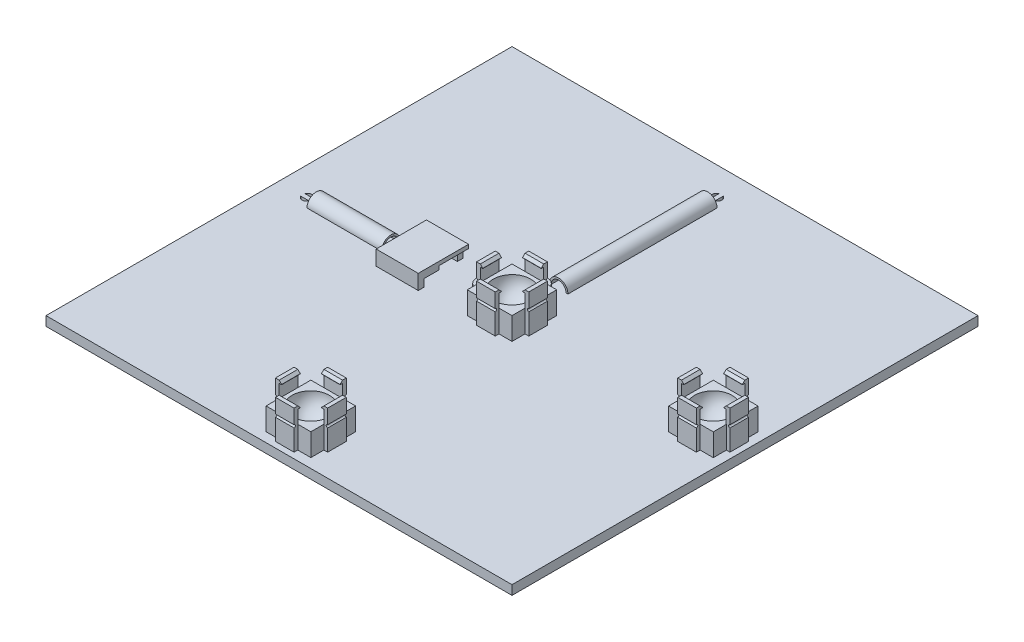
from build123d import *

# Parameters (mm, degrees)
SKETCH1_W            = 250
SKETCH1_H            = 250
BOSS_EXTRUDE1_DEPTH  = 5
SKETCH2_W            = 24
SKETCH2_H            = 24
BOSS_EXTRUDE2_DEPTH  = 12
BOSS_EXTRUDE3_DEPTH  = 19
BOSS_EXTRUDE5_DEPTH  = 10
BOSS_EXTRUDE6_DEPTH  = 10
BOSS_EXTRUDE7_DEPTH  = 10
BOSS_EXTRUDE8_DEPTH  = 10
SKETCH12_R           = 0.75
CUT_EXTRUDE1_DEPTH   = 347.058798176
SKETCH13_R           = 0.75
CUT_EXTRUDE2_DEPTH   = 283.931528819
SKETCH14_R           = 0.75
CUT_EXTRUDE3_DEPTH   = 283.931528819
SKETCH15_R           = 0.75
CUT_EXTRUDE4_DEPTH   = 283.931528819
FILLET1_R            = 0.1
CUT_EXTRUDE5_DEPTH   = 2.3
CUT_EXTRUDE6_DEPTH   = 355.313759259
BOSS_EXTRUDE9_START  = -150
BOSS_EXTRUDE9_DEPTH  = 80
BOSS_EXTRUDE10_START = 20
BOSS_EXTRUDE10_DEPTH = 40
BOSS_EXTRUDE11_DEPTH = 6
SKETCH22_W           = 22.6
SKETCH22_H           = 27
BOSS_EXTRUDE12_DEPTH = 2
CUT_EXTRUDE7_START   = -4
SKETCH23_W           = 3
SKETCH23_H           = 8
CUT_EXTRUDE7_DEPTH   = 4
CUT_EXTRUDE8_DEPTH   = 6
BOSS_EXTRUDE13_START = 5
BOSS_EXTRUDE13_DEPTH = 3
BOSS_EXTRUDE14_START = 5
BOSS_EXTRUDE14_DEPTH = 3


with BuildPart() as part:
    # Sketch1 → Boss-Extrude1 (new body)
    with BuildSketch(Plane(origin=(0, 0, 0), x_dir=(1, 0, 0), z_dir=(0, 1, 0))):
        with Locations((125, 125)):
            Rectangle(SKETCH1_W, SKETCH1_H)
    extrude(amount=BOSS_EXTRUDE1_DEPTH)

    # Sketch2 → Boss-Extrude2 (add)
    with BuildSketch(Plane(origin=(0, 5, 0), x_dir=(1, 0, 0), z_dir=(0, 1, 0))):
        with Locations((125, 125)):
            Rectangle(SKETCH2_W, SKETCH2_H)
        with Locations((233, 125)):
            Rectangle(SKETCH2_W, SKETCH2_H)
        with Locations((125, 17.078916875)):
            Rectangle(SKETCH2_W, SKETCH2_H)
    extrude(amount=BOSS_EXTRUDE2_DEPTH)

    # Sketch4 → Cut-Revolve1 (revolve, cut)
    with BuildSketch(Plane(origin=(0, 17, 0), x_dir=(1, 0, 0), z_dir=(0, 1, 0))):
        with BuildLine():
            Line((125, 115), (125, 135))
            ThreePointArc((125, 135), (115, 125), (125, 115))
        make_face()
    revolve(axis=Axis((125, 17, -135), (0, 0, 1)), mode=Mode.SUBTRACT)

    # Sketch4<3> → Cut-Revolve2 (revolve, cut)
    with BuildSketch(Plane(origin=(0, 17, 0), x_dir=(1, 0, 0), z_dir=(0, 1, 0))):
        with BuildLine():
            Line((233, 135), (233, 115))
            ThreePointArc((233, 115), (243, 125), (233, 135))
        make_face()
    revolve(axis=Axis((233, 17, -135), (0, 0, 1)), mode=Mode.SUBTRACT)

    # Sketch4<4> → Cut-Revolve3 (revolve, cut)
    with BuildSketch(Plane(origin=(0, 17, 0), x_dir=(1, 0, 0), z_dir=(0, 1, 0))):
        with BuildLine():
            Line((125, 7), (125, 27))
            ThreePointArc((125, 27), (115, 17), (125, 7))
        make_face()
    revolve(axis=Axis((125, 17, -7), (0, 0, -1)), mode=Mode.SUBTRACT)

    # Sketch5 → Boss-Extrude3 (add)
    with BuildSketch(Plane(origin=(0, 5, 0), x_dir=(1, 0, 0), z_dir=(0, 1, 0))):
        Polygon((125, 137), (130, 137), (130, 139), (120, 139), (120, 137), align=None)
        Polygon((120, 113), (125, 113), (130, 113), (130, 111), (120, 111), align=None)
        Polygon((125, 29.078916875), (130, 29.078916875), (130, 31.078916875), (120, 31.078916875), (120, 29.078916875), align=None)
        Polygon((120, 5.078916875), (125, 5.078916875), (130, 5.078916875), (130, 3.078916875), (120, 3.078916875), align=None)
        Polygon((113, 130), (113, 125), (113, 120), (111, 120), (111, 130), align=None)
        Polygon((137, 125), (137, 120), (139, 120), (139, 130), (137, 130), align=None)
        Polygon((220.921083125, 130), (220.921083125, 125), (220.921083125, 120), (218.921083125, 120), (218.921083125, 130), align=None)
        Polygon((244.921083125, 125), (244.921083125, 120), (246.921083125, 120), (246.921083125, 130), (244.921083125, 130), align=None)
        Polygon((137, 12.078916875), (137, 17.078916875), (137, 22.078916875), (139, 22.078916875), (139, 12.078916875), align=None)
        Polygon((113, 17.078916875), (113, 22.078916875), (111, 22.078916875), (111, 12.078916875), (113, 12.078916875), align=None)
        Polygon((237.921083125, 137), (232.921083125, 137), (227.921083125, 137), (227.921083125, 139), (237.921083125, 139), align=None)
        Polygon((232.921083125, 113), (227.921083125, 113), (227.921083125, 111), (237.921083125, 111), (237.921083125, 113), align=None)
    extrude(amount=BOSS_EXTRUDE3_DEPTH)

    # Sketch8 → Boss-Extrude5 (add)
    with BuildSketch(Plane.ZY.offset(-120)):
        Polygon((-3.078916875, 24), (-6.578916875, 24), (-5.078916875, 25.5), (-3.078916875, 25.5), align=None)
        Polygon((-29.078916875, 25.5), (-27.578916875, 24), (-31.078916875, 24), (-31.078916875, 25.5), align=None)
        Polygon((-111, 24), (-114.5, 24), (-113, 25.5), (-111, 25.5), align=None)
        Polygon((-137, 25.5), (-135.5, 24), (-139, 24), (-139, 25.5), align=None)
    extrude(amount=-BOSS_EXTRUDE5_DEPTH)

    # Sketch9 → Boss-Extrude6 (add)
    with BuildSketch(Plane(origin=(0, 0, -130), x_dir=(-1, 0, 0), z_dir=(0, 0, -1))):
        Polygon((-111, 24), (-114.5, 24), (-113, 25.5), (-111, 25.5), align=None)
        Polygon((-137, 25.5), (-135.5, 24), (-139, 24), (-139, 25.5), align=None)
        Polygon((-218.921083125, 24), (-222.421083125, 24), (-220.921083125, 25.5), (-218.921083125, 25.5), align=None)
        Polygon((-244.921083125, 25.5), (-243.421083125, 24), (-246.921083125, 24), (-246.921083125, 25.5), align=None)
    extrude(amount=-BOSS_EXTRUDE6_DEPTH)

    # Sketch10 → Boss-Extrude7 (add)
    with BuildSketch(Plane(origin=(237.921083125, 0, 0), x_dir=(0, 0, -1), z_dir=(1, 0, 0))):
        Polygon((139, 24), (135.5, 24), (137, 25.5), (139, 25.5), align=None)
        Polygon((111, 25.5), (111, 24), (114.5, 24), (113, 25.5), align=None)
    extrude(amount=-BOSS_EXTRUDE7_DEPTH)

    # Sketch11 → Boss-Extrude8 (add)
    with BuildSketch(Plane.XY.offset(-12.078916875)):
        Polygon((139, 24), (135.5, 24), (137, 25.5), (139, 25.5), align=None)
        Polygon((111, 25.5), (111, 24), (114.5, 24), (113, 25.5), align=None)
    extrude(amount=-BOSS_EXTRUDE8_DEPTH)

    # Sketch12 → Cut-Extrude1 (cut, through all)
    with BuildSketch(Plane.XY.offset(-12.078916875)):
        with Locations((139, 17)):
            Circle(SKETCH12_R)
        with Locations((111, 17)):
            Circle(SKETCH12_R)
    extrude(amount=-CUT_EXTRUDE1_DEPTH, mode=Mode.SUBTRACT)

    # Sketch13 → Cut-Extrude2 (cut, through all)
    with BuildSketch(Plane.ZY.offset(-120)):
        with Locations((-111, 17)):
            Circle(SKETCH13_R)
        with Locations((-139, 17)):
            Circle(SKETCH13_R)
    extrude(amount=-CUT_EXTRUDE2_DEPTH, mode=Mode.SUBTRACT)

    # Sketch14 → Cut-Extrude3 (cut, through all)
    with BuildSketch(Plane(origin=(0, 0, -130), x_dir=(-1, 0, 0), z_dir=(0, 0, -1))):
        with Locations((-218.921083125, 17)):
            Circle(SKETCH14_R)
        with Locations((-246.921083125, 17)):
            Circle(SKETCH14_R)
    extrude(amount=-CUT_EXTRUDE3_DEPTH, mode=Mode.SUBTRACT)

    # Sketch15 → Cut-Extrude4 (cut, through all)
    with BuildSketch(Plane(origin=(130, 0, 0), x_dir=(0, 0, -1), z_dir=(1, 0, 0))):
        with Locations((31.078916875, 17)):
            Circle(SKETCH15_R)
        with Locations((3.078916875, 17)):
            Circle(SKETCH15_R)
    extrude(amount=-CUT_EXTRUDE4_DEPTH, mode=Mode.SUBTRACT)

    # Fillet1
    fillet1_edges = [part.edges().sort_by_distance(p)[0] for p in [
        (232.921083125, 24, -135.5),
        (243.421083125, 24, -125),
        (232.921083125, 24, -114.5),
        (222.421083125, 24, -125),
        (114.5, 24, -125),
        (125, 24, -135.5),
        (125, 24, -114.5),
        (135.5, 24, -125),
        (135.5, 24, -17.078916875),
        (125, 24, -6.578916875),
        (114.5, 24, -17.078916875),
        (125, 24, -27.578916875),
    ]]
    fillet(fillet1_edges, radius=FILLET1_R)

    # Sketch17 → Cut-Extrude5 (cut)
    with BuildSketch(Plane.XZ):
        with BuildLine():
            Line((125.35, -232.7), (124.65, -232.7))
            ThreePointArc((124.65, -232.7), (122.35, -235), (124.65, -237.3))
            Line((124.65, -237.3), (125, -237.3))
            Line((125, -237.3), (125.35, -237.3))
            ThreePointArc((125.35, -237.3), (127.65, -235), (125.35, -232.7))
        make_face()
        with BuildLine():
            ThreePointArc((12.7, -125.35), (15, -127.65), (17.3, -125.35))
            Line((17.3, -125.35), (17.3, -124.65))
            ThreePointArc((17.3, -124.65), (15, -122.35), (12.7, -124.65))
            Line((12.7, -124.65), (12.7, -125.35))
        make_face()
    extrude(amount=-CUT_EXTRUDE5_DEPTH, mode=Mode.SUBTRACT)

    # Sketch18 → Cut-Extrude6 (cut, through all)
    with BuildSketch(Plane.XZ.offset(-2.3)):
        with BuildLine():
            Line((12.843614135, -123.85), (17.156385865, -123.85))
            ThreePointArc((17.156385865, -123.85), (15, -122.35), (12.843614135, -123.85))
        make_face()
        with BuildLine():
            ThreePointArc((12.843614135, -126.15), (15, -127.65), (17.156385865, -126.15))
            Line((17.156385865, -126.15), (12.843614135, -126.15))
        make_face()
        with BuildLine():
            Line((123.85, -237.156385865), (123.85, -232.843614135))
            ThreePointArc((123.85, -232.843614135), (122.35, -235), (123.85, -237.156385865))
        make_face()
        with BuildLine():
            ThreePointArc((126.15, -237.156385865), (127.65, -235), (126.15, -232.843614135))
            Line((126.15, -232.843614135), (126.15, -237.156385865))
        make_face()
    extrude(amount=-CUT_EXTRUDE6_DEPTH, mode=Mode.SUBTRACT)

    # Sketch19 → Boss-Extrude9 (add)
    with BuildSketch(Plane.XY.offset(BOSS_EXTRUDE9_START)):
        with BuildLine():
            Line((120, 5), (121, 5))
            ThreePointArc((121, 5), (125, 9), (129, 5))
            Line((129, 5), (130, 5))
            ThreePointArc((130, 5), (125, 10), (120, 5))
        make_face()
    extrude(amount=-BOSS_EXTRUDE9_DEPTH)

    # Sketch20 → Boss-Extrude10 (add)
    with BuildSketch(Plane(origin=(0, 0, 0), x_dir=(0, 0, -1), z_dir=(1, 0, 0)).offset(BOSS_EXTRUDE10_START)):
        with BuildLine():
            Line((120, 5), (121, 5))
            ThreePointArc((121, 5), (125, 9), (129, 5))
            Line((129, 5), (130, 5))
            ThreePointArc((130, 5), (125, 10), (120, 5))
        make_face()
    extrude(amount=BOSS_EXTRUDE10_DEPTH)

    # Sketch21 → Boss-Extrude11 (add)
    with BuildSketch(Plane(origin=(0, 5, 0), x_dir=(1, 0, 0), z_dir=(0, 1, 0))):
        Polygon((85.204623334, 138.5), (65.604623334, 138.5), (65.604623334, 111.5), (85.204623334, 111.5), (88.204623334, 111.5), (88.204623334, 122.5), (85.204623334, 122.5), (85.204623334, 114.5), (68.604623334, 114.5), (68.604623334, 135.5), (85.204623334, 135.5), align=None)
    extrude(amount=BOSS_EXTRUDE11_DEPTH)

    # Sketch22 → Boss-Extrude12 (add)
    with BuildSketch(Plane(origin=(0, 11, 0), x_dir=(1, 0, 0), z_dir=(0, 1, 0))):
        with Locations((76.904623334, 125)):
            Rectangle(SKETCH22_W, SKETCH22_H)
    extrude(amount=BOSS_EXTRUDE12_DEPTH)

    # Sketch23 → Cut-Extrude7 (cut)
    with BuildSketch(Plane(origin=(0, 13, 0), x_dir=(1, 0, 0), z_dir=(0, 1, 0)).offset(CUT_EXTRUDE7_START)):
        with Locations((86.704623334, 118.5)):
            Rectangle(SKETCH23_W, SKETCH23_H)
    extrude(amount=-CUT_EXTRUDE7_DEPTH, mode=Mode.SUBTRACT)

    # Sketch24 → Cut-Extrude8 (cut)
    with BuildSketch(Plane.ZY.offset(-65.604623334)):
        with BuildLine():
            Line((-127, 5), (-123, 5))
            ThreePointArc((-123, 5), (-125, 7), (-127, 5))
        make_face()
    extrude(amount=-CUT_EXTRUDE8_DEPTH, mode=Mode.SUBTRACT)

    # Sketch26 → Boss-Extrude13 (add)
    with BuildSketch(Plane(origin=(0, 5, 0), x_dir=(1, 0, 0), z_dir=(0, 1, 0)).offset(BOSS_EXTRUDE13_START)):
        with BuildLine():
            Line((111, 130), (111, 128))
            ThreePointArc((111, 128), (108, 125), (111, 122))
            Line((111, 122), (111, 120))
            ThreePointArc((111, 120), (106, 125), (111, 130))
        make_face()
    extrude(amount=BOSS_EXTRUDE13_DEPTH)

    # Sketch27 → Boss-Extrude14 (add)
    with BuildSketch(Plane(origin=(0, 5, 0), x_dir=(1, 0, 0), z_dir=(0, 1, 0)).offset(BOSS_EXTRUDE14_START)):
        with BuildLine():
            Line((120, 139), (122, 139))
            ThreePointArc((122, 139), (125, 142), (128, 139))
            Line((128, 139), (130, 139))
            ThreePointArc((130, 139), (125, 144), (120, 139))
        make_face()
    extrude(amount=BOSS_EXTRUDE14_DEPTH)


solid = part.part
